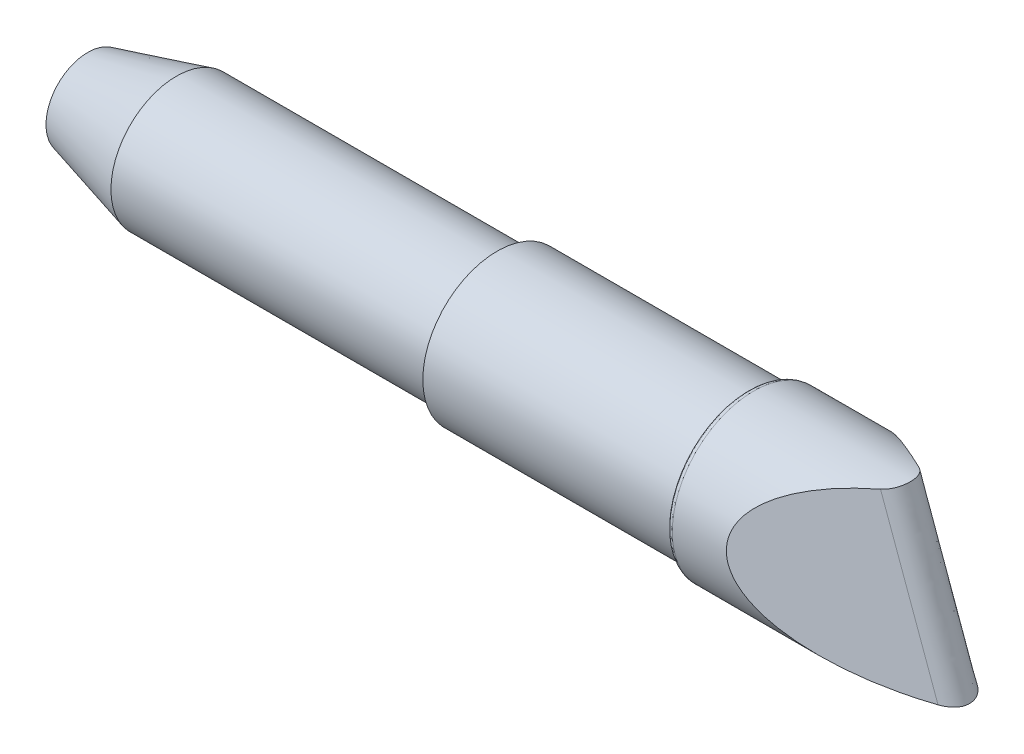
from build123d import *

# Parameters (mm, degrees)
CORTE_EXTRUS_O1_DEPTH = 5
CORTE_EXTRUS_O2_DEPTH = 10
FILETE1_R             = 0.2


with BuildPart() as part:
    # Esboço1 → Revolução1 (revolve)
    with BuildSketch(Plane.XY, mode=Mode.PRIVATE) as revolu_o1_sk:
        Polygon((0, 0), (0, 1.335), (2.836358614, 2.095), (13.09, 2.095), (13.09, 2.375), (21.09, 2.375), (21.09, 2.6), (22.469186813, 2.6), (28.2, 2.6), (28.2, 0), align=None)
    revolve(revolu_o1_sk.sketch.rotate(Axis((0, 0, 0), (1, 0, 0)), 90), axis=Axis((0, 0, 0), (1, 0, 0)))

    # Esboço2 → Corte-extrusão1 (cut, symmetric)
    with BuildSketch(Plane.XY):
        Polygon((28.2, -2.6), (25.943384548, 3.6), (29, 3.6), (29, -2.6), align=None)
    extrude(amount=CORTE_EXTRUS_O1_DEPTH, both=True, mode=Mode.SUBTRACT)

    # Esboço3 → Corte-extrusão2 (cut, along a direction that is not the sketch's normal)
    with BuildSketch(Plane(origin=(-3.863561719, -2.6, 0), x_dir=(0, 0, 1), z_dir=(0, 1, 0))):
        with BuildLine():
            Line((-4.077730135, 25.063561719), (-0.611977577, 31.692934924))
            ThreePointArc((-0.611977577, 31.692934924), (0, 32.063561719), (0.611977577, 31.692934924))
            Line((0.611977577, 31.692934924), (4.077730135, 25.063561719))
            ThreePointArc((4.077730135, 25.063561719), (0, 41.665104992), (-4.077730135, 25.063561719))
        make_face()
    extrude(amount=CORTE_EXTRUS_O2_DEPTH, dir=(-0.3420201433256694, 0.9396926207859082, 0), mode=Mode.SUBTRACT)

    # Filete1
    filete1_edges = [part.edges().sort_by_distance(p)[0] for p in [
        (21.09, 0, -2.6),
    ]]
    fillet(filete1_edges, radius=FILETE1_R)


solid = part.part
